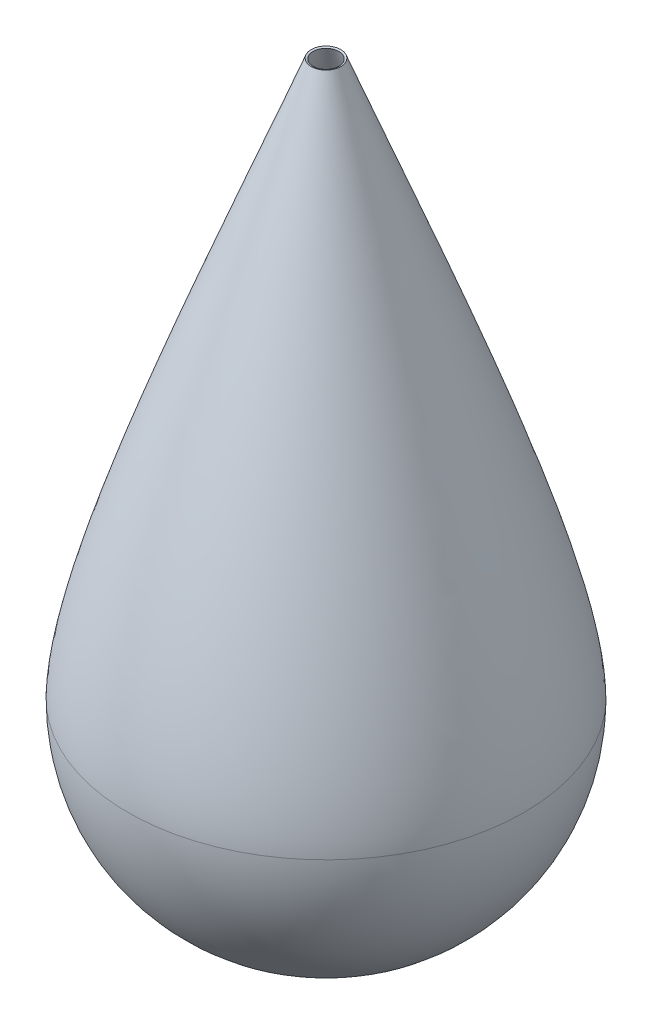
from build123d import *


with BuildPart() as part:
    # Sketch1 → Revolve4 (revolve)
    with BuildSketch(Plane.XY):
        with BuildLine():
            Line((7.457151618, 280), (6.522830238, 279.643568297))
            add(Edge.make_bspline(
                [(98.999999355, -0.011298186), (98.990968468, 0.385949145), (98.966778102, 1.17253763), (98.891983411, 2.806950219), (98.750377332, 4.920678067), (98.504629159, 7.580420594), (98.07802926, 11.28194151), (97.36316351, 16.193994459), (96.227751842, 22.518976728), (94.828043778, 29.250291327), (92.62725137, 38.735159595), (89.282728263, 51.487878792), (84.427815777, 68.038643917), (78.839734984, 85.65163863), (72.626793479, 104.142468116), (63.654090885, 129.722244608), (53.864711151, 156.322933157), (43.691432055, 183.211651478), (35.977660764, 203.339235117), (28.288243733, 223.244824822), (21.990666572, 239.495740074), (17.073051869, 252.202201599), (13.45793674, 261.563740484), (10.519654584, 269.200116569), (8.21552879, 275.21155004), (7.088316346, 278.161248523), (6.522830238, 279.643568297)],
                knots=[7.4931e-05, 7.4931e-05, 7.4931e-05, 7.4931e-05, 0.007886846, 0.01569876, 0.031322589, 0.046946419, 0.062570248, 0.093817906, 0.125065565, 0.156313223, 0.187560881, 0.250056198, 0.312551515, 0.375046832, 0.437542149, 0.500037465, 0.625028099, 0.687523416, 0.750018733, 0.81251405, 0.875009366, 0.906257025, 0.937504683, 0.968752342, 0.984376171, 1, 1, 1, 1], degree=3))
            ThreePointArc((98.999999355, -0.011298186), (69.999576712, -70.007565735), (0, -99))
            Line((0, -99), (0, -100))
            ThreePointArc((0, -100), (70.710678119, -70.710678119), (100, 0))
            add(Edge.make_bspline(
                [(100, 0), (98.852099948, 50.838783961), (43.396187044, 185.792304913), (7.457151618, 280)],
                knots=[0, 0, 0, 0, 1, 1, 1, 1], degree=3))
        make_face()
    revolve(axis=Axis((0, 0, 0), (0, 1, 0)))


solid = part.part
